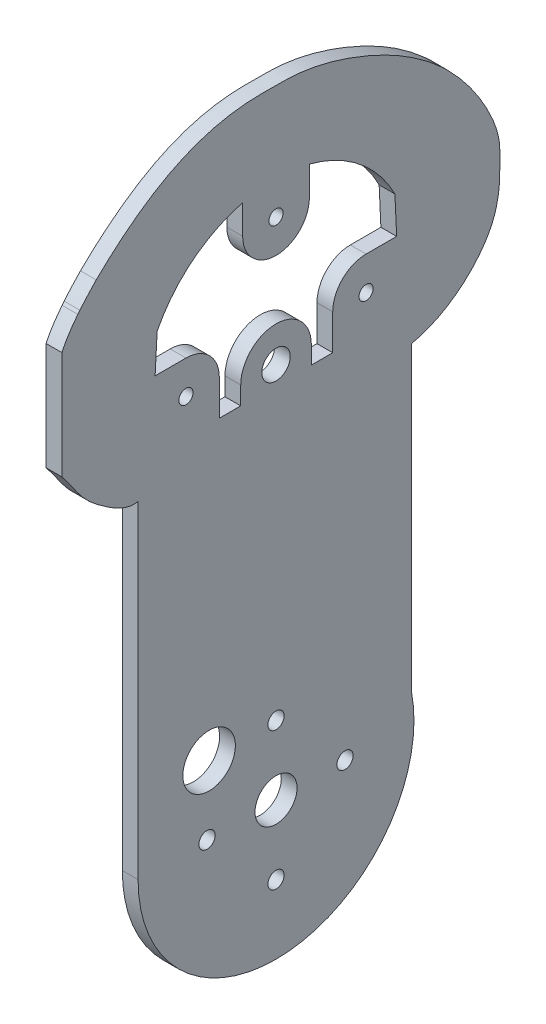
from build123d import *

# Parameters (mm, degrees)
ESQUISSE4_R        = 1.55
ESQUISSE4_R_2      = 4
ESQUISSE4_R_3      = 5
ESQUISSE4_R_4      = 1.35255
ESQUISSE4_R_5      = 2.7051
BOSS_EXTRU_3_DEPTH = 3


with BuildPart() as part:
    # Esquisse4 → Boss.-Extru.3 (new body)
    with BuildSketch(Plane(origin=(0, 0, 0), x_dir=(0, 0, -1), z_dir=(1, 0, 0))):
        with BuildLine():
            Line((-40.60825, -12.7), (-40.60825, -16.144875))
            Line((-40.60825, -16.144875), (-40.60825, -16.348305132))
            add(Edge.make_bspline(
                [(-40.60825, -16.348305132), (-40.365634485, -16.661193605), (-40.112338127, -16.96547542), (-39.63020507, -17.593748723), (-39.400688032, -17.917191992), (-38.719045939, -18.893089111), (-38.271947044, -19.549593057), (-37.338540998, -20.831006808), (-36.855460104, -21.458516341), (-36.059725811, -22.342477591), (-35.781944124, -22.627029047), (-35.202868212, -23.17718548), (-34.900674383, -23.443503751), (-33.971943166, -24.212706181), (-33.324405882, -24.685383849), (-32.010805282, -25.604549776), (-31.348089528, -26.055770333), (-30.303090708, -26.660610546), (-29.948270215, -26.848696892), (-29.222483721, -27.184971005), (-28.851412004, -27.333773538), (-28.083597976, -27.570691368), (-27.685315555, -27.657976057), (-27.090666934, -27.715403346), (-26.891908645, -27.722631025), (-26.592836888, -27.712936491), (-26.492990431, -27.706278992), (-26.292963936, -27.685632014), (-26.192732932, -27.670522326), (-26.092449031, -27.65425)],
                knots=[0, 0, 0, 0, 0.0625, 0.0625, 0.125, 0.125, 0.25, 0.25, 0.375, 0.375, 0.4375, 0.4375, 0.5, 0.5, 0.625, 0.625, 0.75, 0.75, 0.8125, 0.8125, 0.875, 0.875, 0.9375, 0.9375, 0.96875, 0.96875, 0.984375, 0.984375, 1, 1, 1, 1], degree=3))
            Line((-26.092449031, -27.65425), (-26.092449031, -90))
            ThreePointArc((-26.092449031, -90), (2.64551669, -116.14013034), (25.954024412, -85.06135051))
            Line((25.954024412, -85.06135051), (25.954024412, -27.65425))
            add(Edge.make_bspline(
                [(25.954024412, -27.65425), (27.179118802, -27.419536533), (28.353377808, -27.051803075), (30.05705383, -26.34918771), (30.615126485, -26.089288473), (31.712904721, -25.521429223), (32.254485024, -25.212118815), (33.827204106, -24.230350536), (34.814025463, -23.502087852), (36.672007358, -21.907218093), (37.543320305, -21.040793316), (38.751902771, -19.623473398), (39.134714509, -19.134962989), (39.851014333, -18.131439591), (40.185535135, -17.615291382), (40.801362362, -16.550595558), (41.082635497, -16.002027673), (41.457015911, -15.150237789), (41.574249194, -14.86042264), (41.789713906, -14.277065554), (41.888049248, -13.98351322), (42.334688534, -12.506770959), (42.546239761, -11.296312151), (42.717568356, -9.451511475), (42.750611649, -8.83067761), (42.772859866, -7.900507946), (42.775360474, -7.590422151), (42.77555993, -6.970221998), (42.772087252, -6.66010067), (42.772087252, -6.35)],
                knots=[0, 0, 0, 0, 0.125, 0.125, 0.1875, 0.1875, 0.25, 0.25, 0.375, 0.375, 0.5, 0.5, 0.5625, 0.5625, 0.625, 0.625, 0.6875, 0.6875, 0.71875, 0.71875, 0.75, 0.75, 0.875, 0.875, 0.9375, 0.9375, 0.96875, 0.96875, 1, 1, 1, 1], degree=3))
            add(Edge.make_bspline(
                [(42.772087252, -6.35), (42.772087252, -5.874878454), (42.783792207, -5.398095979), (42.789657917, -4.447020546), (42.781867467, -3.973004463), (42.672546396, -2.563152451), (42.499179213, -1.637510108), (42.106282017, -0.267897459), (41.954068536, 0.185625042), (41.614819435, 1.087728793), (41.430081297, 1.530283034), (40.844911495, 2.839259084), (40.416604561, 3.689518781), (39.046783283, 6.190525131), (38.013123304, 7.787251584), (36.291657446, 10.082106977), (35.688509547, 10.830664164), (34.43654182, 12.281738953), (33.786199883, 12.985690235), (33.112075, 13.668565083)],
                knots=[0, 0, 0, 0, 0.0625, 0.0625, 0.125, 0.125, 0.25, 0.25, 0.3125, 0.3125, 0.375, 0.375, 0.5, 0.5, 0.75, 0.75, 0.875, 0.875, 1, 1, 1, 1], degree=3))
            add(Edge.make_bspline(
                [(33.112075, 13.668565083), (32.332207955, 14.539101946), (31.435060987, 15.277734234)],
                knots=[0, 0, 0, 1, 1, 1], degree=2))
            add(Edge.make_bspline(
                [(31.435060987, 15.277734234), (30.299691041, 16.309376592), (29.113704516, 17.275445235), (26.646604831, 19.084346085), (25.360475951, 19.928267183), (21.432297769, 22.265681686), (18.70167828, 23.563722979), (14.477833082, 25.213127628), (13.049229105, 25.71486416), (10.864398428, 26.369911185), (10.129061703, 26.571832136), (8.64156399, 26.936524394), (7.890831572, 27.098844789), (5.637990782, 27.512412208), (4.127431428, 27.693727696), (2.225306731, 27.768676851), (1.844136038, 27.775542931), (1.080940786, 27.779973661), (0.698904769, 27.777413484), (-0.446346689, 27.779064109), (-1.208874123, 27.797823926), (-2.732682239, 27.815308111), (-3.492085471, 27.806304753), (-5.004084105, 27.739990771), (-5.756994671, 27.684916502), (-8.006157922, 27.451797552), (-9.492662784, 27.204583891), (-11.701987236, 26.688775277), (-12.434852331, 26.491461598), (-13.894254142, 26.051929085), (-14.622118919, 25.807493497), (-16.765417144, 25.01223388), (-18.151500369, 24.400517874), (-20.847821735, 23.032525232), (-22.158708475, 22.277484827), (-24.716496252, 20.645447351), (-25.966430559, 19.7652326), (-28.39125747, 17.919703458), (-29.567431908, 16.954258357), (-31.287557173, 15.454109034), (-31.85380584, 14.945666112), (-32.972832423, 13.91291508), (-33.52577931, 13.388805977), (-34.066096443, 12.849822171)],
                knots=[0, 0, 0, 0, 0.0625, 0.0625, 0.125, 0.125, 0.25, 0.25, 0.3125, 0.3125, 0.34375, 0.34375, 0.375, 0.375, 0.4375, 0.4375, 0.453125, 0.453125, 0.46875, 0.46875, 0.5, 0.5, 0.53125, 0.53125, 0.5625, 0.5625, 0.625, 0.625, 0.65625, 0.65625, 0.6875, 0.6875, 0.75, 0.75, 0.8125, 0.8125, 0.875, 0.875, 0.9375, 0.9375, 0.96875, 0.96875, 1, 1, 1, 1], degree=3))
            add(Edge.make_bspline(
                [(-34.066096443, 12.849822171), (-35.159801618, 11.692162737), (-36.251081621, 10.53740284), (-37.166580532, 9.404947171)],
                knots=[0, 0, 0, 0, 1, 1, 1, 1], degree=3))
            ThreePointArc((-37.166580532, 9.404947171), (-37.363014685, 9.160281042), (-37.557796616, 8.914297524))
            add(Edge.make_bspline(
                [(-37.557796616, 8.914297524), (-38.142933539, 8.170182683), (-38.709522845, 7.412667282), (-39.741912272, 5.824816801), (-40.203133529, 4.998794666), (-40.60825, 4.142494902)],
                knots=[0, 0, 0, 0, 0.5, 0.5, 1, 1, 1, 1], degree=3))
            Line((-40.60825, 4.142494902), (-40.60825, -12.7))
        make_face()
        with Locations((0.1651, -103.128774516)):
            Circle(ESQUISSE4_R, mode=Mode.SUBTRACT)
        with Locations((-12.963674516, -90)):
            Circle(ESQUISSE4_R, mode=Mode.SUBTRACT)
        with Locations((0.1651, -90)):
            Circle(ESQUISSE4_R_2, mode=Mode.SUBTRACT)
        with Locations((-12.571436854, -77.1426291)):
            Circle(ESQUISSE4_R_3, mode=Mode.SUBTRACT)
        with Locations((0.1651, -76.871225484)):
            Circle(ESQUISSE4_R, mode=Mode.SUBTRACT)
        with Locations((13.293874516, -90)):
            Circle(ESQUISSE4_R, mode=Mode.SUBTRACT)
        with Locations((-16.9799, -14.9225)):
            Circle(ESQUISSE4_R_4, mode=Mode.SUBTRACT)
        with Locations((0.1651, -18.2245)):
            Circle(ESQUISSE4_R_5, mode=Mode.SUBTRACT)
        with BuildLine():
            Line((-6.1849, 11.646916554), (-6.1849, 6.103472306))
            ThreePointArc((-6.1849, 6.103472306), (0.1651, -0.246527694), (6.5151, 6.103472306))
            Line((6.5151, 6.103472306), (6.5151, 11.646916554))
            ThreePointArc((6.5151, 11.646916554), (16.056799278, 6.86795928), (22.793325, -1.408614826))
            Line((22.793325, -1.408614826), (23.12590424, -8.5725))
            Line((23.12590424, -8.5725), (17.3101, -8.5725))
            ThreePointArc((17.3101, -8.5725), (12.819971939, -10.432371939), (10.9601, -14.9225))
            Line((10.9601, -14.9225), (10.9601, -21.669375))
            Line((10.9601, -21.669375), (6.880225, -21.669375))
            Line((6.880225, -21.669375), (6.880225, -18.2245))
            ThreePointArc((6.880225, -18.2245), (0.1651, -11.509375), (-6.550025, -18.2245))
            Line((-6.550025, -18.2245), (-6.550025, -21.669375))
            Line((-6.550025, -21.669375), (-10.6299, -21.669375))
            Line((-10.6299, -21.669375), (-10.6299, -14.9225))
            ThreePointArc((-10.6299, -14.9225), (-12.489771939, -10.432371939), (-16.9799, -8.5725))
            Line((-16.9799, -8.5725), (-22.848998606, -8.5725))
            Line((-22.848998606, -8.5725), (-22.463125, -1.408614826))
            ThreePointArc((-22.463125, -1.408614826), (-15.726599278, 6.86795928), (-6.1849, 11.646916554))
        make_face(mode=Mode.SUBTRACT)
        with Locations((0.1651, 6.103472306)):
            Circle(ESQUISSE4_R_4, mode=Mode.SUBTRACT)
        with Locations((17.3101, -14.9225)):
            Circle(ESQUISSE4_R_4, mode=Mode.SUBTRACT)
    extrude(amount=BOSS_EXTRU_3_DEPTH)


solid = part.part
